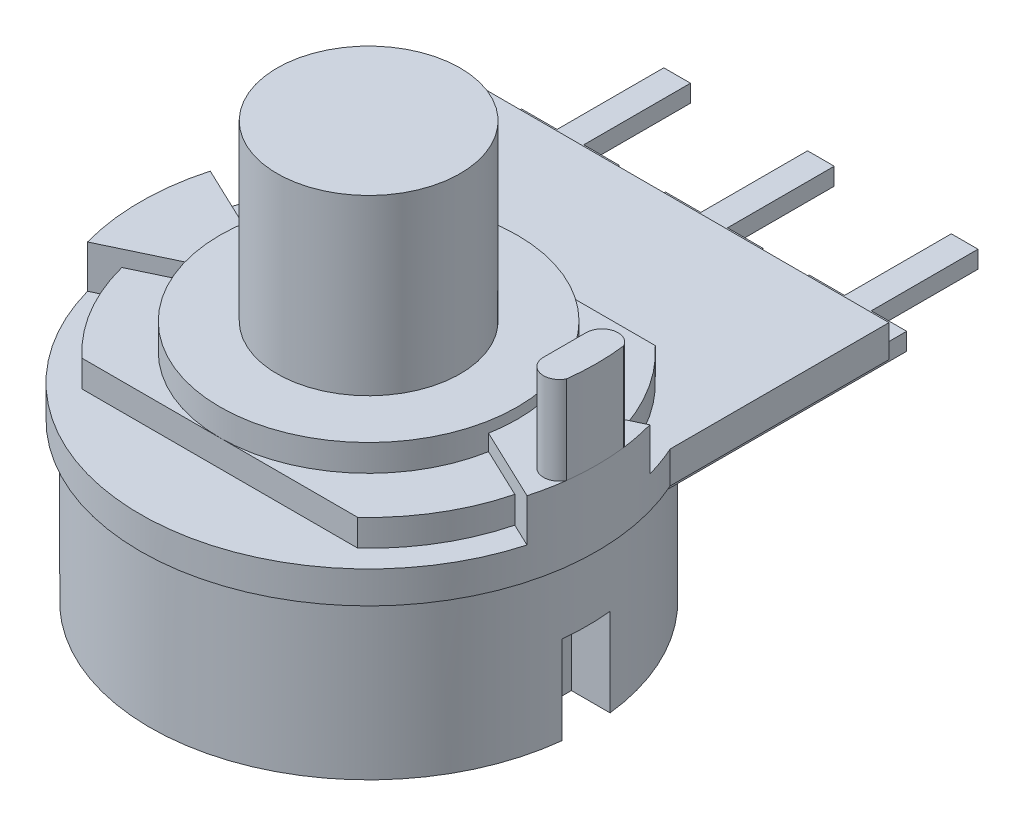
from build123d import *
from build123d.topology import SkipClean

# Parameters (mm, degrees)
BOSS_EXTRUDE1_DEPTH = 3.3
SKETCH2_R           = 8.19
BOSS_EXTRUDE2_DEPTH = 2.6
BOSS_EXTRUDE3_DEPTH = 1.2
BOSS_EXTRUDE4_DEPTH = 1
SKETCH7_R           = 5.575
BOSS_EXTRUDE5_DEPTH = 1
BOSS_EXTRUDE6_DEPTH = 1.6
BOSS_EXTRUDE7_DEPTH = 3.3
SKETCH9_R           = 3.43
BOSS_EXTRUDE8_DEPTH = 6.5
BOSS_EXTRUDE9_START = 0.65
BOSS_EXTRUDE9_DEPTH = 0.65


with BuildPart() as part:
    # Sketch1 → Boss-Extrude1 (new body)
    with BuildSketch(Plane(origin=(0, 0, 0), x_dir=(1, 0, 0), z_dir=(0, 1, 0))):
        with BuildLine():
            Line((8.141120253, -0.893454545), (6.690358093, -0.893454545))
            Line((6.690358093, -0.893454545), (6.690358093, 0.906545455))
            Line((6.690358093, 0.906545455), (8.139672926, 0.906545455))
            ThreePointArc((8.139672926, 0.906545455), (-8.189997352, -0.006585337), (8.141120253, -0.893454545))
        make_face()
    extrude(amount=BOSS_EXTRUDE1_DEPTH)

    # Sketch2 → Boss-Extrude2 (add)
    with BuildSketch(Plane(origin=(0, 3.3, 0), x_dir=(1, 0, 0), z_dir=(0, 1, 0))):
        with Locations(Location((0, 0, 0), (0, 0, 6.355052824))):
            Circle(SKETCH2_R)
    extrude(amount=BOSS_EXTRUDE2_DEPTH)

    # Sketch3 → Boss-Extrude3 (add)
    with BuildSketch(Plane(origin=(0, 5.9, 0), x_dir=(1, 0, 0), z_dir=(0, 1, 0))):
        with BuildLine():
            Line((7.8, 11.7), (-7.8, 11.7))
            Line((-7.8, 11.7), (-7.8, 3.501785259))
            ThreePointArc((-7.8, 3.501785259), (0, -8.55), (7.8, 3.501785259))
            Line((7.8, 3.501785259), (7.8, 11.7))
        make_face()
    extrude(amount=BOSS_EXTRUDE3_DEPTH)

    # Sketch4 → Boss-Extrude4 (add)
    with BuildSketch(Plane(origin=(0, 7.1, 0), x_dir=(1, 0, 0), z_dir=(0, 1, 0))):
        with BuildLine():
            Line((5.165208127, 5.575), (-5.165208127, 5.575))
            ThreePointArc((-5.165208127, 5.575), (-7.6, 0), (-5.165208127, -5.575))
            Line((-5.165208127, -5.575), (5.165208127, -5.575))
            ThreePointArc((5.165208127, -5.575), (7.6, 0), (5.165208127, 5.575))
        make_face()
    extrude(amount=BOSS_EXTRUDE4_DEPTH)

    # Sketch7 → Boss-Extrude5 (add)
    with BuildSketch(Plane(origin=(0, 8.1, 0), x_dir=(1, 0, 0), z_dir=(0, 1, 0))):
        with Locations(Location((0, 0, 0), (0, 0, 270))):
            Circle(SKETCH7_R)
    extrude(amount=BOSS_EXTRUDE5_DEPTH)

    # Sketch6 → Boss-Extrude6 (add)
    with SkipClean():  # the faces are left unmerged after this step: merging them gives an invalid solid
        with BuildSketch(Plane(origin=(0, 7.1, 0), x_dir=(1, 0, 0), z_dir=(0, 1, 0))):
            with BuildLine():
                Line((8.234834546, 2.3), (5.485974002, 0.992327692))
                ThreePointArc((5.485974002, 0.992327692), (5.575, 0), (5.485974002, -0.992327692))
                Line((5.485974002, -0.992327692), (8.234834546, -2.3))
                ThreePointArc((8.234834546, -2.3), (8.55, 0), (8.234834546, 2.3))
            make_face()
            with BuildLine():
                Line((-5.485974002, -0.992327692), (-8.234834546, -2.3))
                ThreePointArc((-8.234834546, -2.3), (-8.55, 0), (-8.234834546, 2.3))
                Line((-8.234834546, 2.3), (-5.485974002, 0.992327692))
                ThreePointArc((-5.485974002, 0.992327692), (-5.575, 0), (-5.485974002, -0.992327692))
            make_face()
        extrude(amount=BOSS_EXTRUDE6_DEPTH)

    # Sketch8 → Boss-Extrude7 (add)
    with SkipClean():  # the faces are left unmerged after this step: merging them gives an invalid solid
        with BuildSketch(Plane(origin=(0, 8.7, 0), x_dir=(1, 0, 0), z_dir=(0, 1, 0))):
            with BuildLine():
                Line((7.35, 0.79614814), (7.35, -0.79614814))
                ThreePointArc((7.35, -0.79614814), (7.807638503, -1.379024154), (8.482458308, -1.072763351))
                ThreePointArc((8.482458308, -1.072763351), (8.55002457, 0), (8.482458308, 1.072763351))
                ThreePointArc((8.482458308, 1.072763351), (7.807638503, 1.379024154), (7.35, 0.79614814))
            make_face()
        extrude(amount=BOSS_EXTRUDE7_DEPTH)

    # Sketch9 → Boss-Extrude8 (add)
    with SkipClean():  # the faces are left unmerged after this step: merging them gives an invalid solid
        with BuildSketch(Plane(origin=(0, 9.1, 0), x_dir=(1, 0, 0), z_dir=(0, 1, 0))):
            with Locations(Location((0, 0, 0), (0, 0, 90))):
                Circle(SKETCH9_R)
        extrude(amount=BOSS_EXTRUDE8_DEPTH)

    # Sketch13 → Boss-Extrude9 (add)
    with SkipClean():  # the faces are left unmerged after this step: merging them gives an invalid solid
        with BuildSketch(Plane.XZ.offset(-5.9).offset(BOSS_EXTRUDE9_START)):
            with BuildLine():
                Line((1.825, -7.98407634), (1.825, -12.95))
                Line((1.825, -12.95), (0.4975, -12.95))
                Line((0.4975, -12.95), (0.4975, -16.95))
                Line((0.4975, -16.95), (-0.5025, -16.95))
                Line((-0.5025, -16.95), (-0.5025, -12.95))
                Line((-0.5025, -12.95), (-1.83, -12.95))
                Line((-1.83, -12.95), (-1.83, -7.982931792))
                ThreePointArc((-1.83, -7.982931792), (-0.002564663, -8.189999598), (1.825, -7.98407634))
            make_face()
            with BuildLine():
                Line((4.884652449, -16.95), (4.884652449, -12.95))
                Line((4.884652449, -12.95), (3.557152449, -12.95))
                Line((3.557152449, -12.95), (3.557152449, -7.37717876))
                ThreePointArc((3.557152449, -7.37717876), (5.661322251, -5.9182371), (7.212152449, -3.880844889))
                Line((7.212152449, -3.880844889), (7.212152449, -12.95))
                Line((7.212152449, -12.95), (5.884652449, -12.95))
                Line((5.884652449, -12.95), (5.884652449, -16.95))
                Line((5.884652449, -16.95), (4.884652449, -16.95))
            make_face()
            with BuildLine():
                Line((-5.889652449, -16.95), (-4.889652449, -16.95))
                Line((-4.889652449, -16.95), (-4.889652449, -12.95))
                Line((-4.889652449, -12.95), (-3.562152449, -12.95))
                Line((-3.562152449, -12.95), (-3.562152449, -7.374765754))
                ThreePointArc((-3.562152449, -7.374765754), (-5.667142471, -5.912664054), (-7.217152449, -3.871538522))
                Line((-7.217152449, -3.871538522), (-7.217152449, -12.95))
                Line((-7.217152449, -12.95), (-5.889652449, -12.95))
                Line((-5.889652449, -12.95), (-5.889652449, -16.95))
            make_face()
        extrude(amount=-BOSS_EXTRUDE9_DEPTH)


solid = part.part
